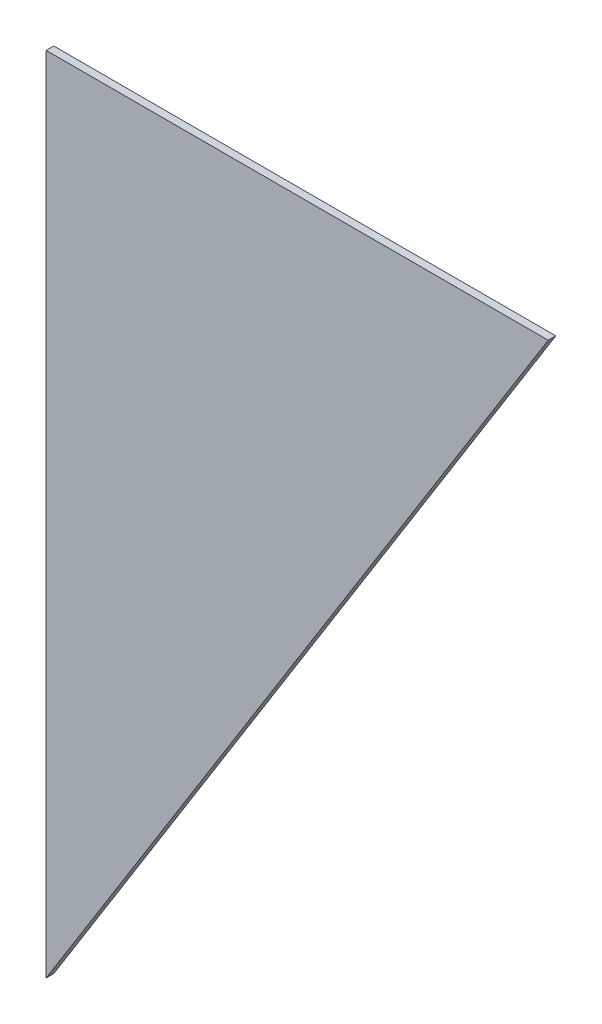
from build123d import *

# Parameters (mm, degrees)
BOSS_EXTRUDE1_DEPTH = 3


with BuildPart() as part:
    # Sketch1 → Boss-Extrude1 (new body)
    with BuildSketch(Plane.XY):
        Polygon((-200, -3), (-200, -320), (-1.875, -3), align=None)
    extrude(amount=BOSS_EXTRUDE1_DEPTH)


solid = part.part
